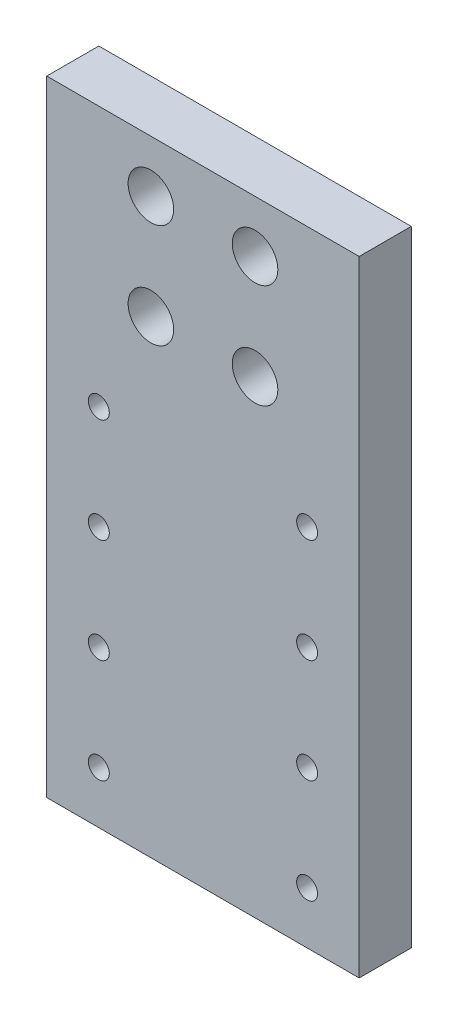
from build123d import *

# Parameters (mm, degrees)
SKETCH1_W                                        = 76.2
SKETCH1_H                                        = 152.4
BOSS_EXTRUDE1_DEPTH                              = 12.7
CBORE_FOR_1_4_SOCKET_HEAD_CAP_SCREW1_D           = 6.7564
CBORE_FOR_1_4_SOCKET_HEAD_CAP_SCREW1_CBORE_D     = 11.1125
CBORE_FOR_1_4_SOCKET_HEAD_CAP_SCREW1_CBORE_DEPTH = 8.89
CBORE_FOR_10_SOCKET_HEAD_CAP_SCREW1_D            = 5.1054
CBORE_FOR_10_SOCKET_HEAD_CAP_SCREW1_CBORE_D      = 9.525
CBORE_FOR_10_SOCKET_HEAD_CAP_SCREW1_CBORE_DEPTH  = 7.366


with BuildPart() as part:
    # Sketch1 → Boss-Extrude1 (new body)
    with BuildSketch(Plane.XY):
        with Locations((0, -50.8)):
            Rectangle(SKETCH1_W, SKETCH1_H)
    extrude(amount=BOSS_EXTRUDE1_DEPTH)

    # CBORE for 1/4 Socket Head Cap Screw1 (through all)
    with Locations(Plane.XY.offset(12.7)):
        with Locations((-12.7, 12.7), (-12.7, -12.7), (12.7, -12.7), (12.7, 12.7)):
            CounterBoreHole(CBORE_FOR_1_4_SOCKET_HEAD_CAP_SCREW1_D / 2, CBORE_FOR_1_4_SOCKET_HEAD_CAP_SCREW1_CBORE_D / 2, CBORE_FOR_1_4_SOCKET_HEAD_CAP_SCREW1_CBORE_DEPTH)

    # CBORE for #10 Socket Head Cap Screw1 (through all)
    with Locations(Plane(origin=(0, 0, 0), x_dir=(-1, 0, 0), z_dir=(0, 0, -1))):
        with Locations((-25.4, -114.3), (25.4, -114.3), (25.4, -88.9), (25.4, -63.5), (25.4, -38.1), (-25.4, -88.9), (-25.4, -63.5), (-25.4, -38.1)):
            CounterBoreHole(CBORE_FOR_10_SOCKET_HEAD_CAP_SCREW1_D / 2, CBORE_FOR_10_SOCKET_HEAD_CAP_SCREW1_CBORE_D / 2, CBORE_FOR_10_SOCKET_HEAD_CAP_SCREW1_CBORE_DEPTH)


solid = part.part
